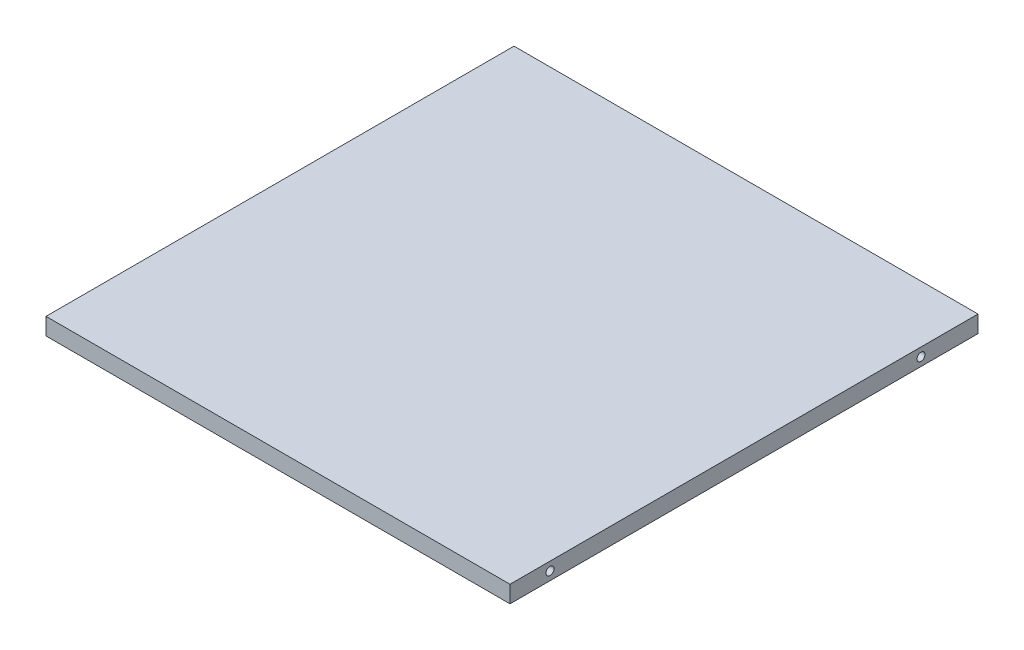
from build123d import *

# Parameters (mm, degrees)
SKETCH1_W           = 464
SKETCH1_H           = 468
BOSS_EXTRUDE1_DEPTH = 17
SKETCH3_R           = 4
CUT_EXTRUDE1_DEPTH  = 25
CUT_EXTRUDE2_START  = -25
SKETCH4_R           = 4
CUT_EXTRUDE2_DEPTH  = 25


with BuildPart() as part:
    # Sketch1 → Boss-Extrude1 (new body)
    with BuildSketch(Plane(origin=(0, 0, 0), x_dir=(1, 0, 0), z_dir=(0, 1, 0))):
        with Locations((232, 234)):
            Rectangle(SKETCH1_W, SKETCH1_H)
    extrude(amount=BOSS_EXTRUDE1_DEPTH)

    # Sketch3 → Cut-Extrude1 (cut)
    with BuildSketch(Plane(origin=(464, 0, 0), x_dir=(0, 0, -1), z_dir=(1, 0, 0))):
        with Locations((40, 8.5)):
            Circle(SKETCH3_R)
        with Locations((411, 8.5)):
            Circle(SKETCH3_R)
    extrude(amount=-CUT_EXTRUDE1_DEPTH, mode=Mode.SUBTRACT)

    # Sketch4 → Cut-Extrude2 (cut)
    with BuildSketch(Plane.ZY.offset(CUT_EXTRUDE2_START)):
        with Locations(Location((-411, 8.5, 0), (0, 0, 180))):
            Circle(SKETCH4_R)
        with Locations(Location((-40, 8.5, 0), (0, 0, 180))):
            Circle(SKETCH4_R)
    extrude(amount=CUT_EXTRUDE2_DEPTH, mode=Mode.SUBTRACT)


solid = part.part
